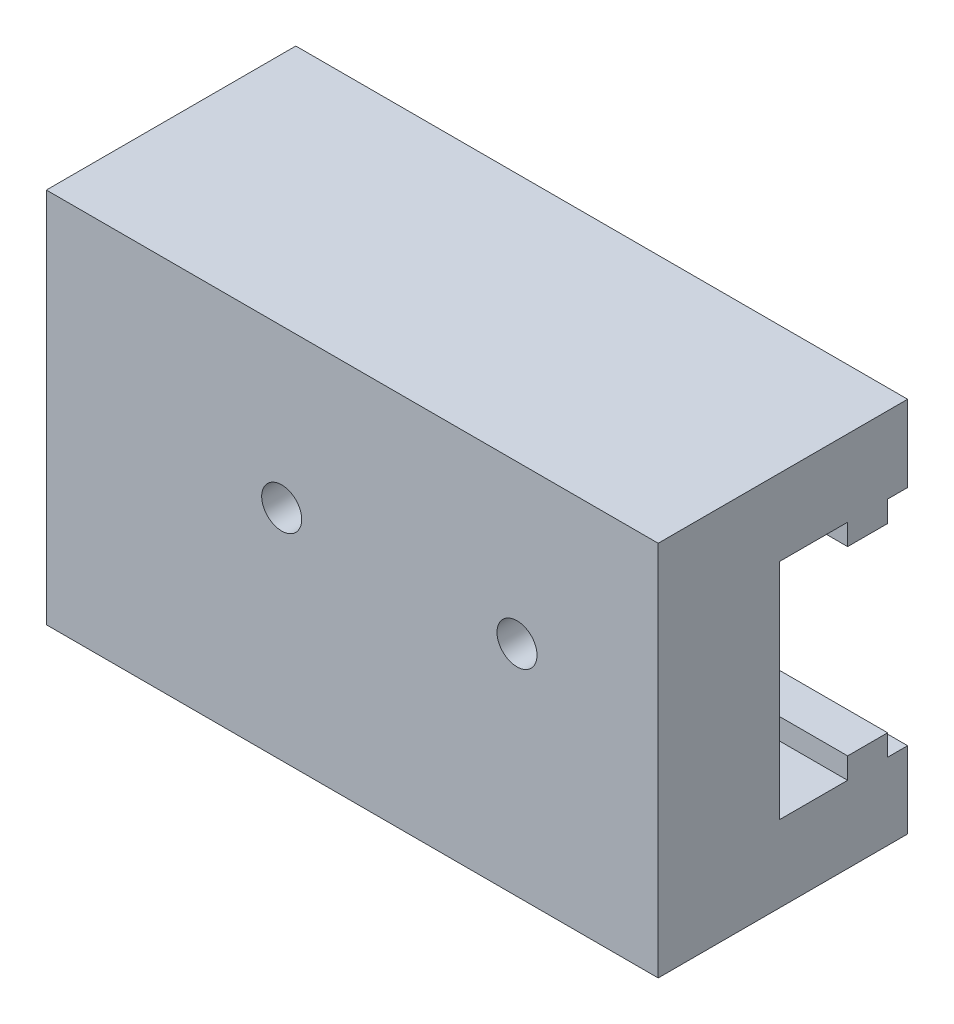
from build123d import *

# Parameters (mm, degrees)
CARRIAGE_START                    = 29.8
CARRIAGE_BLOCK_PROFILE_W          = 26
CARRIAGE_BLOCK_PROFILE_H          = 16
CARRIAGE_BLOCK_DEPTH              = 10.6
RAIL_START                        = 29.7
RAIL_RUNNING_CLEARANCE_PROFILE_W  = 26.2
RAIL_RUNNING_CLEARANCE_PROFILE_H  = 9.5
RAIL_RUNNING_CLEARANCE_DEPTH      = 5.55
LONGITUDINAL_START                = 30.65
LONGITUDINAL_GUIDE_KEYS_PROFILE_W = 26
LONGITUDINAL_GUIDE_KEYS_PROFILE_H = 1
LONGITUDINAL_GUIDE_KEYS_DEPTH     = 1.7
CARRIAGE_START_2                  = 36.9
CARRIAGE_SCREW_PILOTS_PROFILE_R   = 0.85
CARRIAGE_SCREW_PILOTS_DEPTH       = 3.6


with BuildPart() as part:
    # Carriage block profile → Carriage block (new body)
    with BuildSketch(Plane.XY.offset(CARRIAGE_START)):
        with Locations((8, 18.5)):
            Rectangle(CARRIAGE_BLOCK_PROFILE_W, CARRIAGE_BLOCK_PROFILE_H)
    extrude(amount=CARRIAGE_BLOCK_DEPTH)

    # Rail running clearance profile → Rail running clearance (cut)
    with BuildSketch(Plane.XY.offset(RAIL_START)):
        with Locations((8, 18.5)):
            Rectangle(RAIL_RUNNING_CLEARANCE_PROFILE_W, RAIL_RUNNING_CLEARANCE_PROFILE_H)
    extrude(amount=RAIL_RUNNING_CLEARANCE_DEPTH, mode=Mode.SUBTRACT)

    # Longitudinal guide keys profile → Longitudinal guide keys (add)
    with BuildSketch(Plane.XY.offset(LONGITUDINAL_START)):
        with Locations((8, 14.15)):
            Rectangle(LONGITUDINAL_GUIDE_KEYS_PROFILE_W, LONGITUDINAL_GUIDE_KEYS_PROFILE_H)
        with Locations((8, 22.85)):
            Rectangle(LONGITUDINAL_GUIDE_KEYS_PROFILE_W, LONGITUDINAL_GUIDE_KEYS_PROFILE_H)
    extrude(amount=LONGITUDINAL_GUIDE_KEYS_DEPTH)

    # Carriage screw pilots profile → Carriage screw pilots (cut)
    with BuildSketch(Plane.XY.offset(CARRIAGE_START_2)):
        with Locations((5, 19.8)):
            Circle(CARRIAGE_SCREW_PILOTS_PROFILE_R)
        with Locations((15, 19.8)):
            Circle(CARRIAGE_SCREW_PILOTS_PROFILE_R)
    extrude(amount=CARRIAGE_SCREW_PILOTS_DEPTH, mode=Mode.SUBTRACT)


solid = part.part
